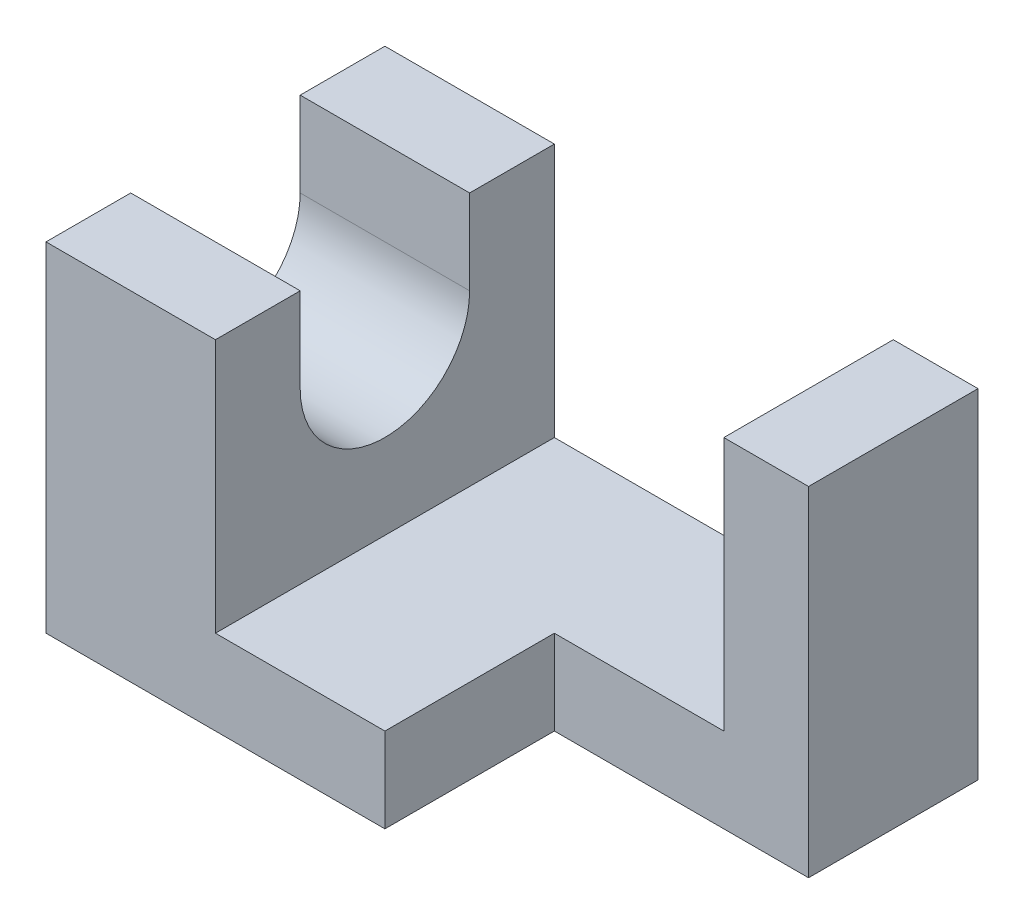
from build123d import *

# Parameters (mm, degrees)
SKETCH_1_W          = 70
SKETCH_1_H          = 40
EXTRUDE_1_DEPTH     = 40
SKETCH_2_W          = 40
SKETCH_2_H          = 30
CUT_EXTRUDE_1_DEPTH = 40
SKETCH_3_W          = 30
SKETCH_3_H          = 20
CUT_EXTRUDE_2_DEPTH = 40
CUT_EXTRUDE_3_DEPTH = 40


with BuildPart() as part:
    # 스케치1 → 보스-돌출1 (new body)
    with BuildSketch(Plane.XY):
        with Locations((35, 20)):
            Rectangle(SKETCH_1_W, SKETCH_1_H)
    extrude(amount=-EXTRUDE_1_DEPTH)

    # 스케치2 → 컷-돌출1 (cut)
    with BuildSketch(Plane.XY):
        with Locations((40, 25)):
            Rectangle(SKETCH_2_W, SKETCH_2_H)
    extrude(amount=-CUT_EXTRUDE_1_DEPTH, mode=Mode.SUBTRACT)

    # 스케치3 → 컷-돌출2 (cut)
    with BuildSketch(Plane(origin=(0, 40, 0), x_dir=(1, 0, 0), z_dir=(0, 1, 0))):
        with Locations((55, 10)):
            Rectangle(SKETCH_3_W, SKETCH_3_H)
    extrude(amount=-CUT_EXTRUDE_2_DEPTH, mode=Mode.SUBTRACT)

    # 스케치4 → 컷-돌출3 (cut)
    with BuildSketch(Plane.ZY):
        with BuildLine():
            Line((-30, 40), (-30, 30))
            ThreePointArc((-30, 30), (-20, 20), (-10, 30))
            Line((-10, 30), (-10, 40))
            Line((-10, 40), (-30, 40))
        make_face()
    extrude(amount=-CUT_EXTRUDE_3_DEPTH, mode=Mode.SUBTRACT)


solid = part.part
